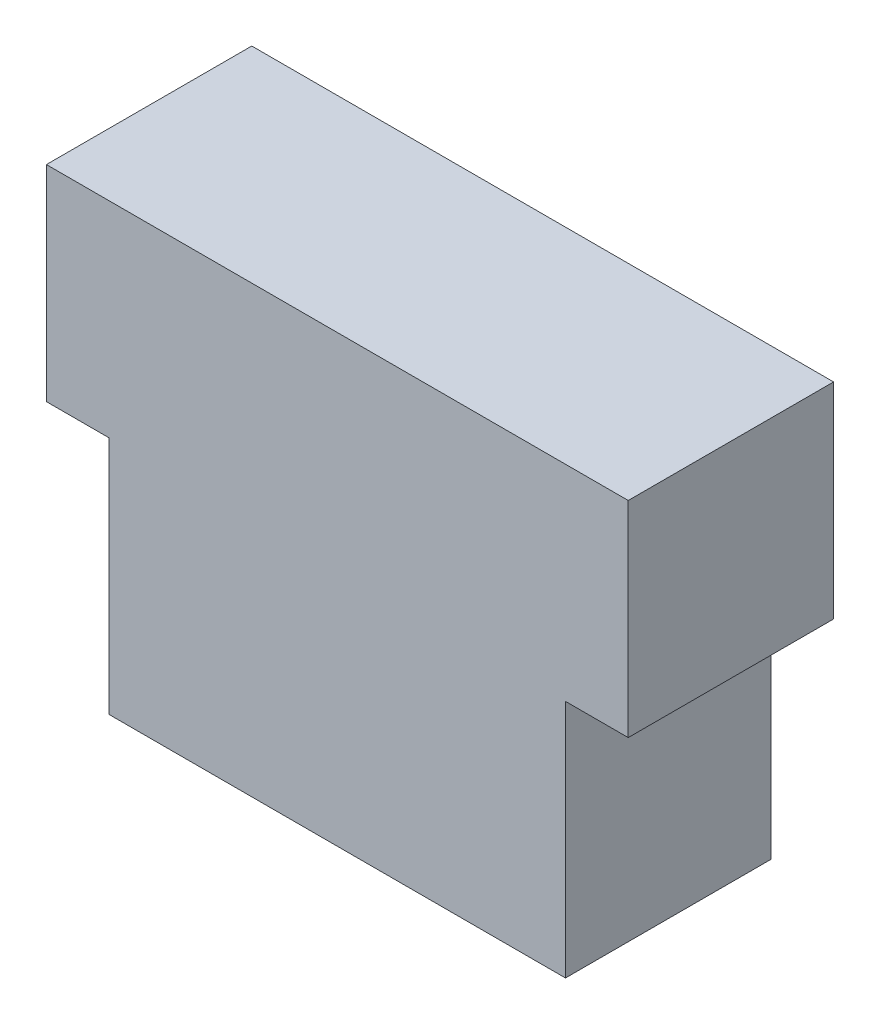
from build123d import *

# Parameters (mm, degrees)
SKETCH_1_W      = 40
SKETCH_1_H      = 39
SKETCH_1_W_2    = 5.5
SKETCH_1_H_2    = 18
EXTRUDE_1_DEPTH = 18


with BuildPart() as part:
    # 草图1 → 凸台-拉伸1 (new body)
    with BuildSketch(Plane.XY):
        Rectangle(SKETCH_1_W, SKETCH_1_H)
        with Locations((-22.75, 10.5)):
            Rectangle(SKETCH_1_W_2, SKETCH_1_H_2)
        with Locations((22.75, 10.5)):
            Rectangle(SKETCH_1_W_2, SKETCH_1_H_2)
    extrude(amount=EXTRUDE_1_DEPTH)


solid = part.part
